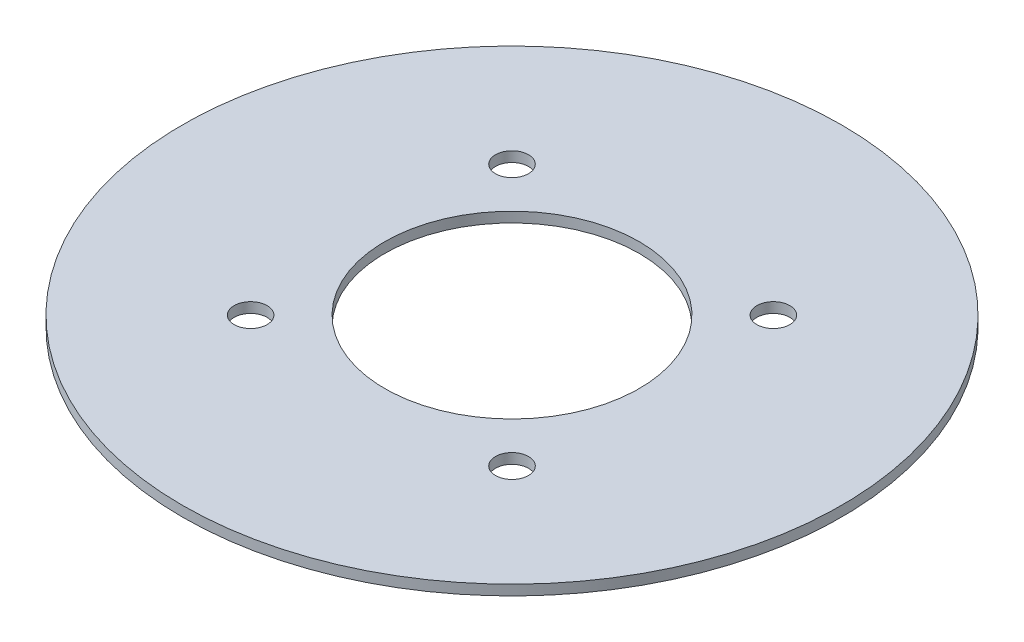
from build123d import *

# Parameters (mm, degrees)
SKETCH_1_R          = 29
EXTRUDE_1_DEPTH     = 0.9
SKETCH_2_R          = 1.45
SKETCH_2_R_2        = 11.2
CUT_EXTRUDE_1_DEPTH = 0.9


with BuildPart() as part:
    # 草图1 → 凸台-拉伸1 (new body)
    with BuildSketch(Plane.XZ.offset(-604.003613165)):
        with Locations(Location((0, 0, 0), (0, 0, 270))):
            Circle(SKETCH_1_R)
    extrude(amount=EXTRUDE_1_DEPTH)

    # 草图2 → 切除-拉伸1 (cut)
    with BuildSketch(Plane.XZ.offset(-603.103613165)):
        with Locations(Location((11.5, -11.5, 0), (0, 0, 270))):
            Circle(SKETCH_2_R)
        with Locations(Location((-11.5, -11.5, 0), (0, 0, 270))):
            Circle(SKETCH_2_R)
        with Locations(Location((11.5, 11.5, 0), (0, 0, 270))):
            Circle(SKETCH_2_R)
        with Locations(Location((-11.5, 11.5, 0), (0, 0, 270))):
            Circle(SKETCH_2_R)
        with Locations(Location((0, 0, 0), (0, 0, 270))):
            Circle(SKETCH_2_R_2)
    extrude(amount=-CUT_EXTRUDE_1_DEPTH, mode=Mode.SUBTRACT)


solid = part.part
